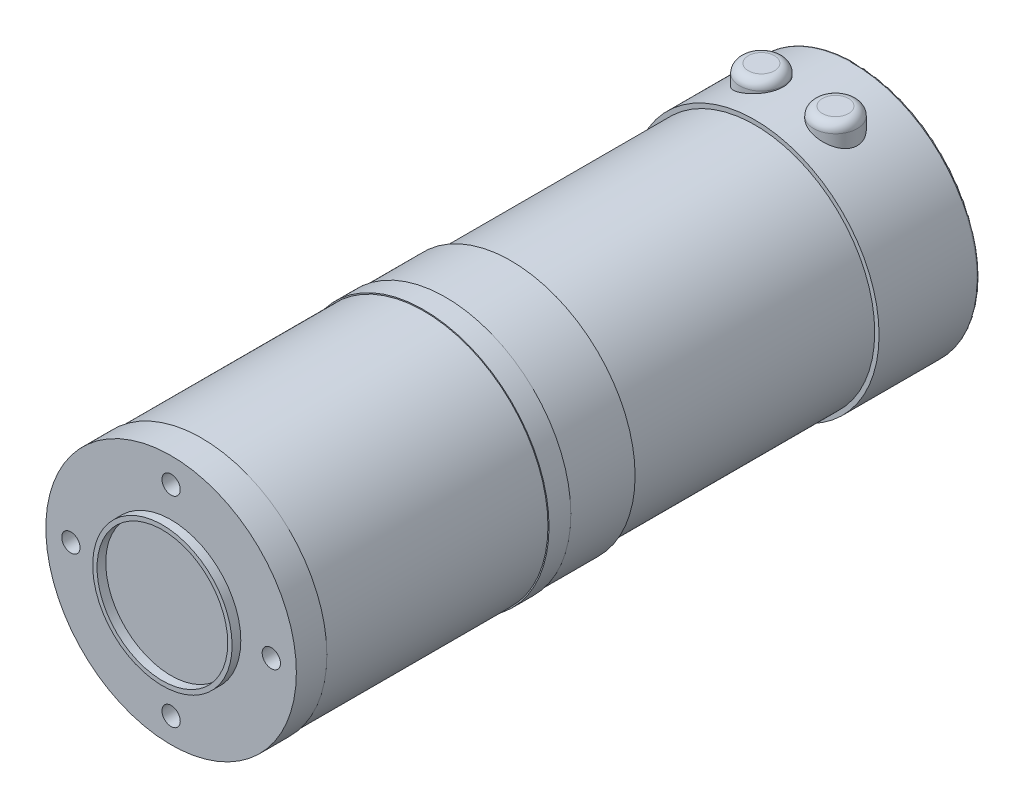
from build123d import *

# Parameters (mm, degrees)
ESQUISSE1_R                  = 28.5
BOSS_EXTRU_1_DEPTH           = 23
ESQUISSE3_R                  = 27.5
BOSS_EXTRU_2_DEPTH           = 56
ESQUISSE4_R                  = 28.5
BOSS_EXTRU_3_DEPTH           = 15
ESQUISSE5_R                  = 28.75
BOSS_EXTRU_4_DEPTH           = 5
ESQUISSE6_R                  = 28.5
BOSS_EXTRU_5_DEPTH           = 51
ESQUISSE7_R                  = 28.75
BOSS_EXTRU_6_DEPTH           = 7
CONG_1_R                     = 0.5
ESQUISSE8_R                  = 16
ESQUISSE8_R_2                = 15
BOSS_EXTRU_7_DEPTH           = 2
R_P_TITION_CIRCULAIRE1_COUNT = 4
BOSS_EXTRU_8_DEPTH           = 2
BOSS_EXTRU_8_DEPTH_BACK      = 10
ESQUISSE12_R                 = 5
CONG_2_R                     = 2


with BuildPart() as part:
    # Esquisse1 → Boss.-Extru.1 (new body)
    with BuildSketch(Plane.XY):
        Circle(ESQUISSE1_R)
    extrude(amount=BOSS_EXTRU_1_DEPTH)

    # Esquisse3 → Boss.-Extru.2 (add)
    with BuildSketch(Plane.XY.offset(23)):
        Circle(ESQUISSE3_R)
    extrude(amount=BOSS_EXTRU_2_DEPTH)

    # Esquisse4 → Boss.-Extru.3 (add)
    with BuildSketch(Plane.XY.offset(79)):
        Circle(ESQUISSE4_R)
    extrude(amount=BOSS_EXTRU_3_DEPTH)

    # Esquisse5 → Boss.-Extru.4 (add)
    with BuildSketch(Plane.XY.offset(94)):
        Circle(ESQUISSE5_R)
    extrude(amount=BOSS_EXTRU_4_DEPTH)

    # Esquisse6 → Boss.-Extru.5 (add)
    with BuildSketch(Plane.XY.offset(99)):
        Circle(ESQUISSE6_R)
    extrude(amount=BOSS_EXTRU_5_DEPTH)

    # Esquisse7 → Boss.-Extru.6 (add)
    with BuildSketch(Plane.XY.offset(150)):
        Circle(ESQUISSE7_R)
    extrude(amount=BOSS_EXTRU_6_DEPTH)

    # Congé1
    cong_1_edges = [part.edges().sort_by_distance(p)[0] for p in [
        (-28.5, 0, 0),
    ]]
    fillet(cong_1_edges, radius=CONG_1_R)

    # Esquisse8 → Boss.-Extru.7 (add)
    with BuildSketch(Plane.XY.offset(157)):
        Circle(ESQUISSE8_R)
        Circle(ESQUISSE8_R_2, mode=Mode.SUBTRACT)
    extrude(amount=BOSS_EXTRU_7_DEPTH)

    # Esquisse10 → Trou pour taraudage pour trou taraudé M51 (revolve, cut)
    with BuildSketch(Plane(origin=(-23, 0, 157), x_dir=(0, -1, 0), z_dir=(1, 0, 0))):
        Polygon((0, 0), (0, 11.2618073), (2.1, 10), (2.1, 0), align=None)
    trou_pour_taraudage_pour_trou_taraud_m5 = revolve(axis=Axis((-23, 0, 163.35), (0, 0, -1)), mode=Mode.SUBTRACT)

    # Répétition circulaire1: Trou pour taraudage pour trou taraudé M51 ×4 about axis
    r_p_tition_circulaire1_axis = Axis((0, 0, 157), (0, 0, -1))
    for i in range(1, R_P_TITION_CIRCULAIRE1_COUNT):
        add(trou_pour_taraudage_pour_trou_taraud_m5.rotate(r_p_tition_circulaire1_axis, i * 360 / R_P_TITION_CIRCULAIRE1_COUNT), mode=Mode.SUBTRACT)

    # Esquisse12 → Boss.-Extru.8 (add, two sides: drawn at the far end of the back side and taken through both)
    with BuildSketch(Plane(origin=(0, 28.5, 0), x_dir=(1, 0, 0), z_dir=(0, 1, 0)).offset(-BOSS_EXTRU_8_DEPTH_BACK)):
        with Locations((-8.5, -13)):
            Circle(ESQUISSE12_R)
        with Locations((8.5, -13)):
            Circle(ESQUISSE12_R)
    extrude(amount=BOSS_EXTRU_8_DEPTH + BOSS_EXTRU_8_DEPTH_BACK)

    # Congé2
    cong_2_edges = [part.edges().sort_by_distance(p)[0] for p in [
        (3.5, 30.5, 13),
        (-13.5, 30.5, 13),
    ]]
    fillet(cong_2_edges, radius=CONG_2_R)


solid = part.part
